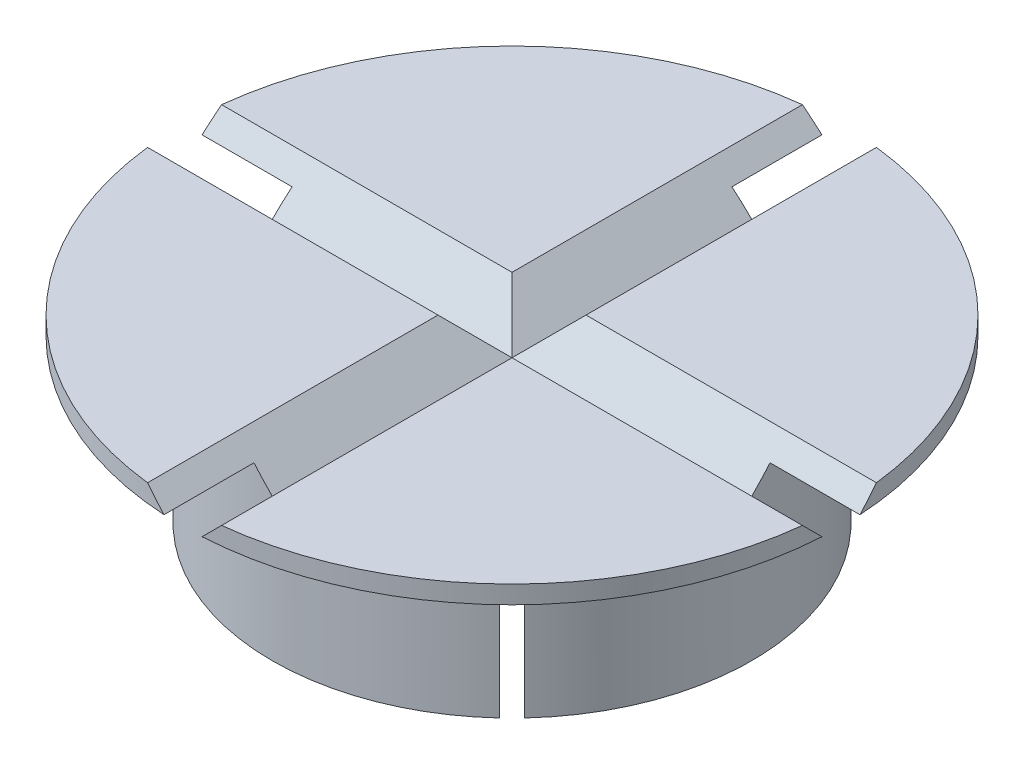
from build123d import *

# Parameters (mm, degrees)
CUT_EXTRUDE1_DEPTH  = 56.621758333
CIRPATTERN1_COUNT   = 4
SKETCH3_R           = 23.75
CUT_EXTRUDE2_DEPTH  = 12
CUT_EXTRUDE3_START  = 12
CUT_EXTRUDE3_DEPTH  = 12
CIRPATTERN2_COUNT   = 4
SKETCH5_R           = 5
SKETCH5_R_2         = 2.35
BOSS_EXTRUDE1_DEPTH = 14
CHAMFER1_SIZE       = 1
CHAMFER2_SIZE       = 5


with BuildPart() as part:
    # Sketch1 → Revolve1 (revolve)
    with BuildSketch(Plane(origin=(0, 0, 0), x_dir=(0, 0, -1), z_dir=(1, 0, 0)), mode=Mode.PRIVATE) as revolve1_sk:
        Polygon((0, 0), (26.7, 0), (26.7, 18), (36.7, 18), (36.7, 20), (0, 20), align=None)
    revolve(revolve1_sk.sketch.rotate(Axis((0, 20, 0), (0, -1, 0)), 180), axis=Axis((0, 20, 0), (0, -1, 0)))

    # Sketch2 → Cut-Extrude1 (cut, symmetric)
    with BuildSketch(Plane.XY):
        Polygon((4.121320344, 20), (0, 15.878679656), (-4.121320344, 20), align=None)
    cut_extrude1 = extrude(amount=CUT_EXTRUDE1_DEPTH, both=True, mode=Mode.SUBTRACT)

    # CirPattern1: Cut-Extrude1 ×4 about axis
    cirpattern1_axis = Axis((0, 0, 0), (0, 1, 0))
    for i in range(1, CIRPATTERN1_COUNT):
        add(cut_extrude1.rotate(cirpattern1_axis, i * 360 / CIRPATTERN1_COUNT), mode=Mode.SUBTRACT)

    # Sketch3 → Cut-Extrude2 (cut)
    with BuildSketch(Plane.XZ):
        with Locations(Location((0, 0, 0), (0, 0, 270))):
            Circle(SKETCH3_R)
    extrude(amount=-CUT_EXTRUDE2_DEPTH, mode=Mode.SUBTRACT)

    # Sketch4 → Cut-Extrude3 (cut)
    with BuildSketch(Plane(origin=(0, 0, 0), x_dir=(1, 0, 0), z_dir=(0, 1, 0)).offset(CUT_EXTRUDE3_START)):
        with BuildLine():
            Line((-25.234076692, -26.648290255), (0, -1.414213562))
            Line((0, -1.414213562), (-1.414213562, 0))
            Line((-1.414213562, 0), (-26.648290255, -25.234076692))
            ThreePointArc((-26.648290255, -25.234076692), (-25.95081887, -25.95081887), (-25.234076692, -26.648290255))
        make_face()
    cut_extrude3 = extrude(amount=-CUT_EXTRUDE3_DEPTH, mode=Mode.SUBTRACT)

    # CirPattern2: Cut-Extrude3 ×4 about axis
    cirpattern2_axis = Axis((0, 0, 0), (0, 1, 0))
    for i in range(1, CIRPATTERN2_COUNT):
        add(cut_extrude3.rotate(cirpattern2_axis, i * 360 / CIRPATTERN2_COUNT), mode=Mode.SUBTRACT)

    # Sketch5 → Boss-Extrude1 (add)
    with BuildSketch(Plane.XZ.offset(-12)):
        with Locations(Location((0, 0, 0), (0, 0, 270))):
            Circle(SKETCH5_R)
        with Locations(Location((0, 0, 0), (0, 0, 270))):
            Circle(SKETCH5_R_2, mode=Mode.SUBTRACT)
    extrude(amount=BOSS_EXTRUDE1_DEPTH)

    # Chamfer1
    chamfer1_edges = [part.edges().sort_by_distance(p)[0] for p in [
        (0, -2, 2.35),
    ]]
    chamfer(chamfer1_edges, length=CHAMFER1_SIZE)

    # Chamfer2
    chamfer2_edges = [part.edges().sort_by_distance(p)[0] for p in [
        (0, 12, 5),
    ]]
    chamfer(chamfer2_edges, length=CHAMFER2_SIZE)


solid = part.part
